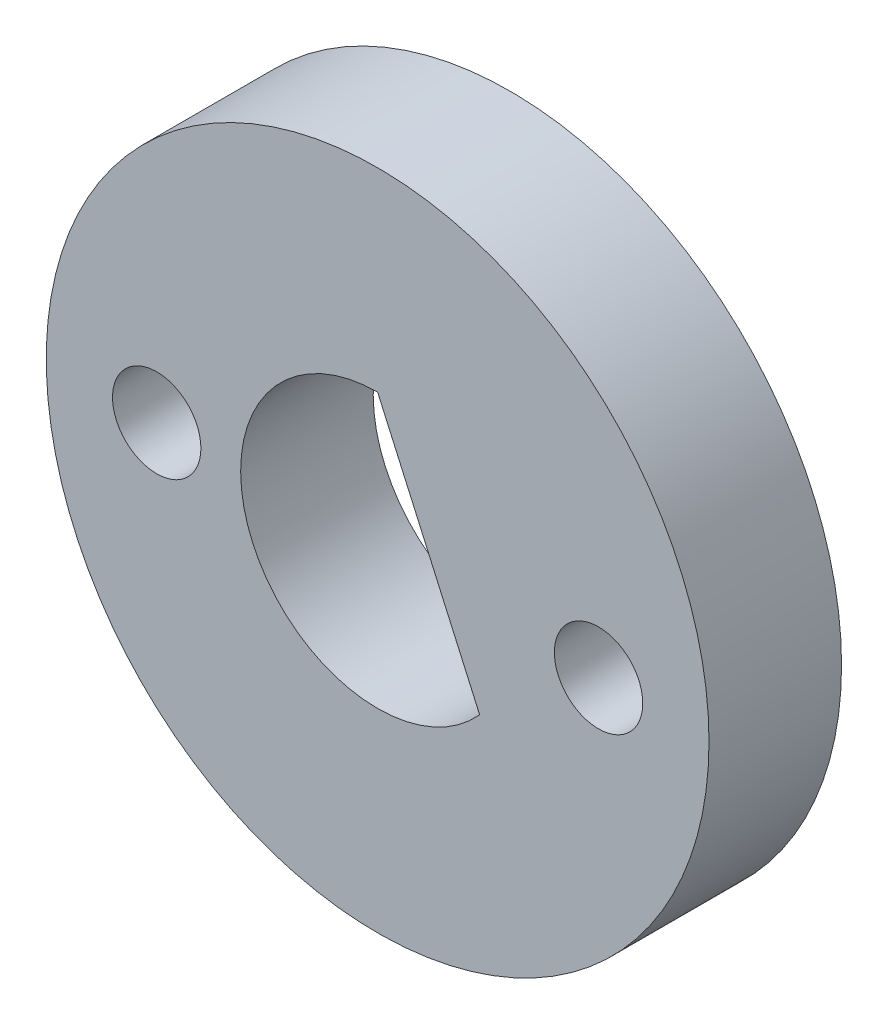
from build123d import *

# Parameters (mm, degrees)
SKETCH1_R             = 7.5
BOSS_EXTRUDE1_DEPTH   = 3
CUT_EXTRUDE1_DEPTH    = 3
F_2_0MM_DOWEL_HOLE1_D = 2


with BuildPart() as part:
    # Sketch1 → Boss-Extrude1 (new body)
    with BuildSketch(Plane.XY):
        Circle(SKETCH1_R)
    extrude(amount=BOSS_EXTRUDE1_DEPTH)

    # Sketch2 → Cut-Extrude1 (cut)
    with BuildSketch(Plane.XY.offset(3)):
        with BuildLine():
            Line((0, 3.1), (2.308854941, -2.068620038))
            ThreePointArc((2.308854941, -2.068620038), (-2.830434783, -1.264372944), (0, 3.1))
        make_face()
    extrude(amount=-CUT_EXTRUDE1_DEPTH, mode=Mode.SUBTRACT)

    # Ø2.0mm Dowel Hole1 (through all)
    with Locations(Plane.XY.offset(3)):
        with Locations((-5, 0), (5, 0)):
            Hole(F_2_0MM_DOWEL_HOLE1_D / 2)


solid = part.part
